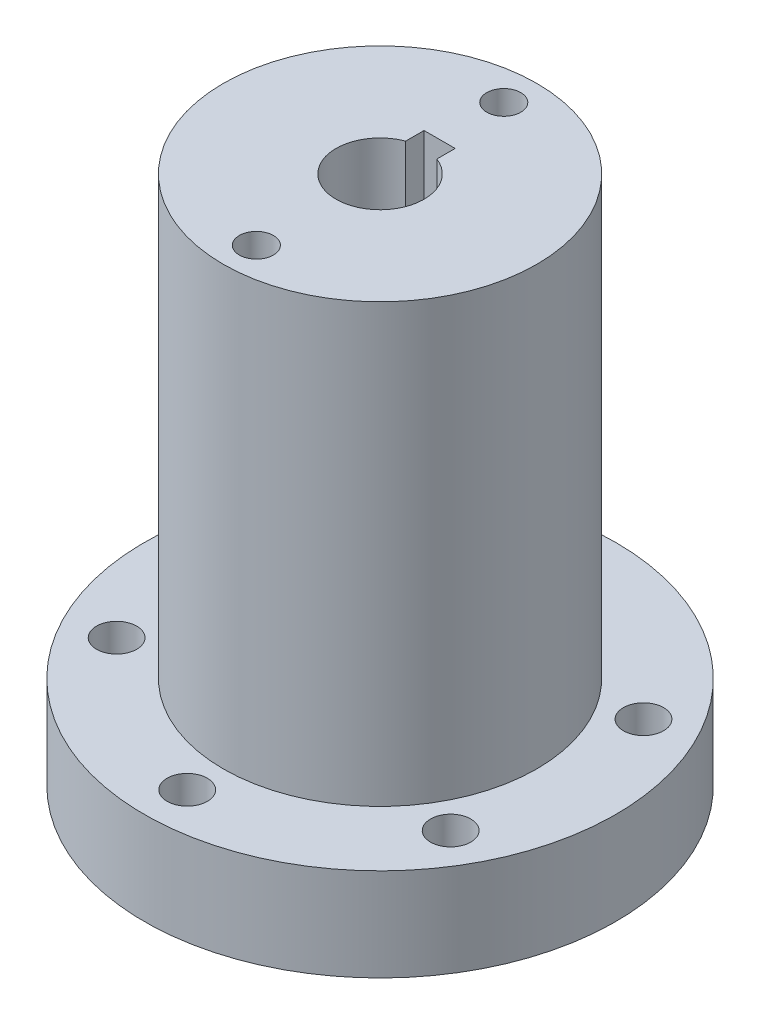
from build123d import *

# Parameters (mm, degrees)
SKETCH1_R           = 25.34
BOSS_EXTRUDE1_DEPTH = 8.5
SKETCH2_R           = 25.34
BOSS_EXTRUDE2_DEPTH = 57.15
SKETCH7_R           = 25.34
BOSS_EXTRUDE4_DEPTH = 15
CUT_EXTRUDE3_DEPTH  = 115
SKETCH6_R           = 38.1
BOSS_EXTRUDE3_DEPTH = 15
CUT_EXTRUDE4_DEPTH  = 20
SKETCH10_R          = 2.75
CUT_EXTRUDE6_DEPTH  = 129
BOSS_EXTRUDE5_START = -93
BOSS_EXTRUDE5_DEPTH = 93
CUT_EXTRUDE8_START  = -10
SKETCH12_R          = 25.34
CUT_EXTRUDE8_DEPTH  = 10
SKETCH13_R          = 7.12
CUT_EXTRUDE9_DEPTH  = 40


with BuildPart() as part:
    # Sketch1 → Boss-Extrude1 (new body)
    with BuildSketch(Plane(origin=(0, 0, 0), x_dir=(1, 0, 0), z_dir=(0, 1, 0))):
        with Locations(Location((0, 0, 0), (0, 0, 270))):
            Circle(SKETCH1_R)
    extrude(amount=BOSS_EXTRUDE1_DEPTH)

    # Sketch2 → Boss-Extrude2 (add)
    with BuildSketch(Plane(origin=(0, 8.5, 0), x_dir=(1, 0, 0), z_dir=(0, 1, 0))):
        with Locations(Location((0, 0, 0), (0, 0, 270))):
            Circle(SKETCH2_R)
    extrude(amount=BOSS_EXTRUDE2_DEPTH)

    # Sketch7 → Boss-Extrude4 (add)
    with BuildSketch(Plane(origin=(0, 65.65, 0), x_dir=(1, 0, 0), z_dir=(0, 1, 0))):
        with Locations(Location((0, 0, 0), (0, 0, 270))):
            Circle(SKETCH7_R)
    extrude(amount=BOSS_EXTRUDE4_DEPTH)

    # Sketch5 → Cut-Extrude3 (cut)
    with BuildSketch(Plane.XZ):
        with BuildLine():
            ThreePointArc((2.575, 6.777305881), (0, 7.25), (-2.575, 6.777305881))
            Line((-2.575, 6.777305881), (-2.575, 4))
            Line((-2.575, 4), (2.575, 4))
            Line((2.575, 4), (2.575, 6.777305881))
        make_face()
        with BuildLine():
            Line((-2.575, 4), (-2.575, 6.777305881))
            ThreePointArc((-2.575, 6.777305881), (-4.116658232, -5.96788279), (7.25, 0))
            ThreePointArc((7.25, 0), (5.96788279, 4.116658232), (2.575, 6.777305881))
            Line((2.575, 6.777305881), (2.575, 4))
            Line((2.575, 4), (-2.575, 4))
        make_face()
        with BuildLine():
            Line((2.575, 9.15), (-2.575, 9.15))
            Line((-2.575, 9.15), (-2.575, 6.777305881))
            ThreePointArc((-2.575, 6.777305881), (0, 7.25), (2.575, 6.777305881))
            Line((2.575, 6.777305881), (2.575, 9.15))
        make_face()
    extrude(amount=-CUT_EXTRUDE3_DEPTH, mode=Mode.SUBTRACT)

    # Sketch6 → Boss-Extrude3 (add)
    with BuildSketch(Plane.XZ):
        with Locations(Location((0, 0, 0), (0, 0, 270))):
            Circle(SKETCH6_R)
    extrude(amount=BOSS_EXTRUDE3_DEPTH)

    # Sketch9 → Cut-Extrude4 (cut)
    with BuildSketch(Plane(origin=(0, 0, 0), x_dir=(1, 0, 0), z_dir=(0, 1, 0))):
        with BuildLine():
            ThreePointArc((-23.75, 15.588457268), (-23.860741065, 16.429619165), (-24.185417438, 17.213457268))
            Line((-24.185417438, 17.213457268), (-27, 15.588457268))
            Line((-27, 15.588457268), (-27, 12.338457268))
            ThreePointArc((-27, 12.338457268), (-24.701902961, 13.290360229), (-23.75, 15.588457268))
        make_face()
        with BuildLine():
            Line((-27, 15.588457268), (-24.185417438, 17.213457268))
            ThreePointArc((-24.185417438, 17.213457268), (-29.814582562, 17.213457268), (-27, 12.338457268))
            Line((-27, 12.338457268), (-27, 15.588457268))
        make_face()
        with BuildLine():
            Line((2.814582562, 29.551914536), (0, 31.176914536))
            Line((0, 31.176914536), (-2.814582562, 29.551914536))
            ThreePointArc((-2.814582562, 29.551914536), (0, 27.926914536), (2.814582562, 29.551914536))
        make_face()
        with BuildLine():
            Line((-2.814582562, 29.551914536), (0, 31.176914536))
            Line((0, 31.176914536), (2.814582562, 29.551914536))
            ThreePointArc((2.814582562, 29.551914536), (3.139258935, 30.33575264), (3.25, 31.176914536))
            ThreePointArc((3.25, 31.176914536), (-0.841161897, 34.316173472), (-2.814582562, 29.551914536))
        make_face()
        with BuildLine():
            ThreePointArc((30.25, 15.588457268), (27.841161897, 18.727716204), (24.185417438, 17.213457268))
            Line((24.185417438, 17.213457268), (27, 15.588457268))
            Line((27, 15.588457268), (27, 12.338457268))
            ThreePointArc((27, 12.338457268), (29.298097039, 13.290360229), (30.25, 15.588457268))
        make_face()
        with BuildLine():
            Line((27, 15.588457268), (24.185417438, 17.213457268))
            ThreePointArc((24.185417438, 17.213457268), (24.185417438, 13.963457268), (27, 12.338457268))
            Line((27, 12.338457268), (27, 15.588457268))
        make_face()
        with BuildLine():
            ThreePointArc((30.25, -15.588457268), (29.298097039, -13.290360229), (27, -12.338457268))
            Line((27, -12.338457268), (27, -15.588457268))
            Line((27, -15.588457268), (24.185417438, -17.213457268))
            ThreePointArc((24.185417438, -17.213457268), (27.841161897, -18.727716204), (30.25, -15.588457268))
        make_face()
        with BuildLine():
            Line((27, -15.588457268), (27, -12.338457268))
            ThreePointArc((27, -12.338457268), (24.185417438, -13.963457268), (24.185417438, -17.213457268))
            Line((24.185417438, -17.213457268), (27, -15.588457268))
        make_face()
        with BuildLine():
            ThreePointArc((2.814582562, -29.551914536), (0, -27.926914536), (-2.814582562, -29.551914536))
            Line((-2.814582562, -29.551914536), (0, -31.176914536))
            Line((0, -31.176914536), (2.814582562, -29.551914536))
        make_face()
        with BuildLine():
            Line((0, -31.176914536), (-2.814582562, -29.551914536))
            ThreePointArc((-2.814582562, -29.551914536), (-0.841161897, -34.316173472), (3.25, -31.176914536))
            ThreePointArc((3.25, -31.176914536), (3.139258935, -30.33575264), (2.814582562, -29.551914536))
            Line((2.814582562, -29.551914536), (0, -31.176914536))
        make_face()
        with BuildLine():
            ThreePointArc((-23.75, -15.588457268), (-24.701902961, -13.290360229), (-27, -12.338457268))
            Line((-27, -12.338457268), (-27, -15.588457268))
            Line((-27, -15.588457268), (-24.185417438, -17.213457268))
            ThreePointArc((-24.185417438, -17.213457268), (-23.860741065, -16.429619165), (-23.75, -15.588457268))
        make_face()
        with BuildLine():
            Line((-27, -15.588457268), (-27, -12.338457268))
            ThreePointArc((-27, -12.338457268), (-29.814582562, -17.213457268), (-24.185417438, -17.213457268))
            Line((-24.185417438, -17.213457268), (-27, -15.588457268))
        make_face()
    extrude(amount=-CUT_EXTRUDE4_DEPTH, mode=Mode.SUBTRACT)

    # Sketch10 → Cut-Extrude6 (cut)
    with BuildSketch(Plane(origin=(0, 80.65, 0), x_dir=(1, 0, 0), z_dir=(0, 1, 0))):
        with Locations(Location((0, 20, 0), (0, 0, 270))):
            Circle(SKETCH10_R)
        with Locations(Location((0, -20, 0), (0, 0, 270))):
            Circle(SKETCH10_R)
    extrude(amount=-CUT_EXTRUDE6_DEPTH, mode=Mode.SUBTRACT)

    # Sketch11 → Boss-Extrude5 (add)
    with BuildSketch(Plane(origin=(0, 80.65, 0), x_dir=(1, 0, 0), z_dir=(0, 1, 0)).offset(BOSS_EXTRUDE5_START)):
        with BuildLine():
            Line((-2.575, -6.777305881), (-2.575, -9.15))
            Line((-2.575, -9.15), (0, -9.15))
            Line((0, -9.15), (2.575, -9.15))
            Line((2.575, -9.15), (2.575, -6.777305881))
            ThreePointArc((2.575, -6.777305881), (0, 7.25), (-2.575, -6.777305881))
        make_face()
    extrude(amount=BOSS_EXTRUDE5_DEPTH)

    # Sketch12 → Cut-Extrude8 (cut)
    with BuildSketch(Plane(origin=(0, 80.65, 0), x_dir=(1, 0, 0), z_dir=(0, 1, 0)).offset(CUT_EXTRUDE8_START)):
        with Locations(Location((0, 0, 0), (0, 0, 270))):
            Circle(SKETCH12_R)
    extrude(amount=CUT_EXTRUDE8_DEPTH, mode=Mode.SUBTRACT)

    # Sketch13 → Cut-Extrude9 (cut)
    with BuildSketch(Plane(origin=(0, 70.65, 0), x_dir=(1, 0, 0), z_dir=(0, 1, 0))):
        Polygon((2.51482759, 9.62638963), (2.51482759, 7.12), (0, 7.12), (-2.51482759, 7.12), (-2.51482759, 9.62638963), align=None)
        Circle(SKETCH13_R)
        with BuildLine():
            ThreePointArc((-2.51482759, 6.66108416), (-1.278178543, 7.004331489), (0, 7.12))
            Line((0, 7.12), (-2.51482759, 7.12))
            Line((-2.51482759, 7.12), (-2.51482759, 6.66108416))
        make_face()
        with BuildLine():
            Line((2.51482759, 7.12), (0, 7.12))
            ThreePointArc((0, 7.12), (1.278178543, 7.004331489), (2.51482759, 6.66108416))
            Line((2.51482759, 6.66108416), (2.51482759, 7.12))
        make_face()
    extrude(amount=-CUT_EXTRUDE9_DEPTH, mode=Mode.SUBTRACT)


solid = part.part
